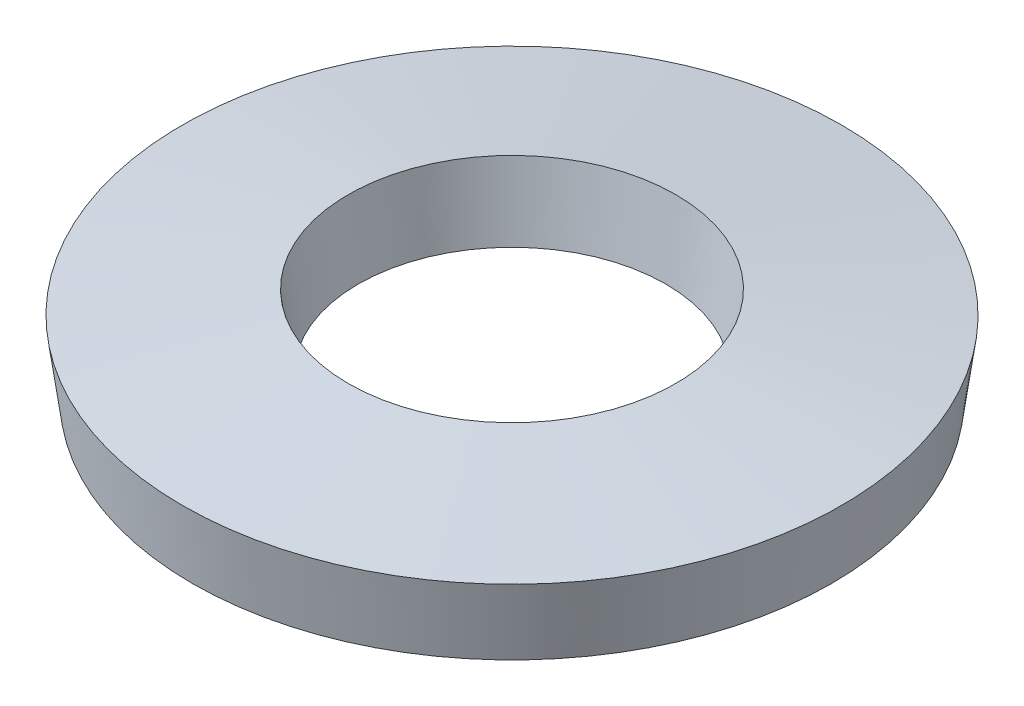
from build123d import *


with BuildPart() as part:
    # Sketch1 → Revolve1 (revolve)
    with BuildSketch(Plane.XY, mode=Mode.PRIVATE) as revolve1_sk:
        Polygon((8.729460636, 0), (4.2, 0.618382365), (4.470539364, 2.6), (9, 1.981617635), align=None)
    revolve(revolve1_sk.sketch.rotate(Axis((0, 0, 0), (0, 1, 0)), 90), axis=Axis((0, 0, 0), (0, 1, 0)))


solid = part.part
